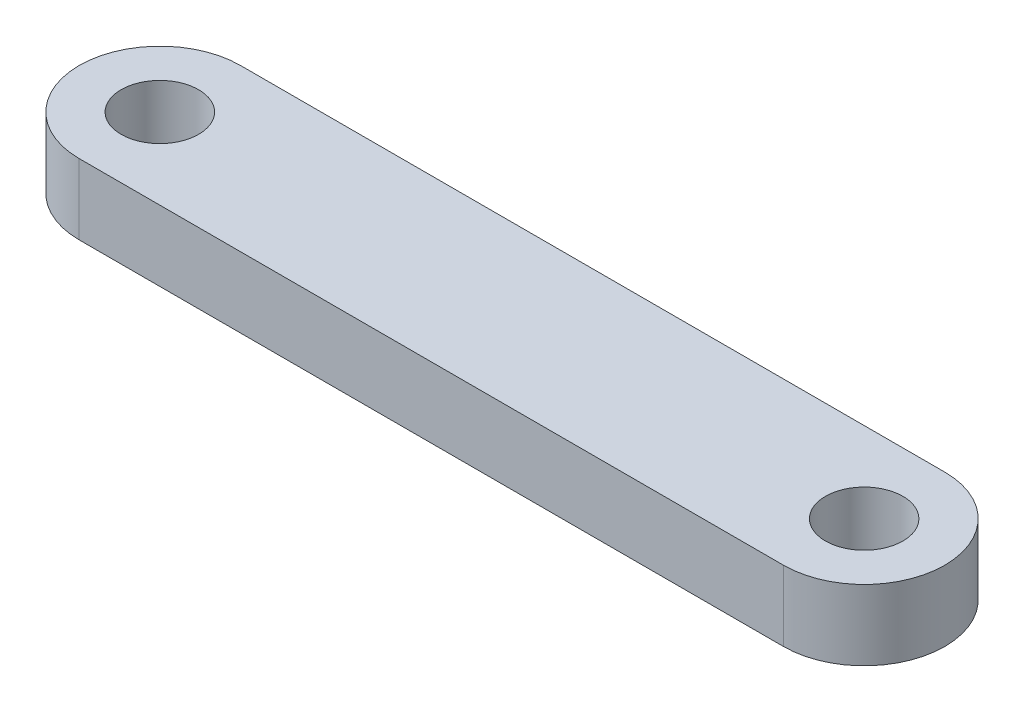
from build123d import *

# Parameters (mm, degrees)
SKETCH_1_R      = 1.65
EXTRUDE_1_DEPTH = 3


with BuildPart() as part:
    # 草图1 → 凸台-拉伸1 (new body)
    with BuildSketch(Plane(origin=(0, 0, 0), x_dir=(1, 0, 0), z_dir=(0, 1, 0))):
        with BuildLine():
            Line((0, 0), (30, 0))
            ThreePointArc((30, 0), (33.435, 3.435), (30, 6.87))
            Line((30, 6.87), (0, 6.87))
            ThreePointArc((0, 6.87), (-3.435, 3.435), (0, 0))
        make_face()
        with Locations(Location((0, 3.435, 0), (0, 0, 270))):
            Circle(SKETCH_1_R, mode=Mode.SUBTRACT)
        with Locations(Location((30, 3.435, 0), (0, 0, 270))):
            Circle(SKETCH_1_R, mode=Mode.SUBTRACT)
    extrude(amount=EXTRUDE_1_DEPTH)


solid = part.part
